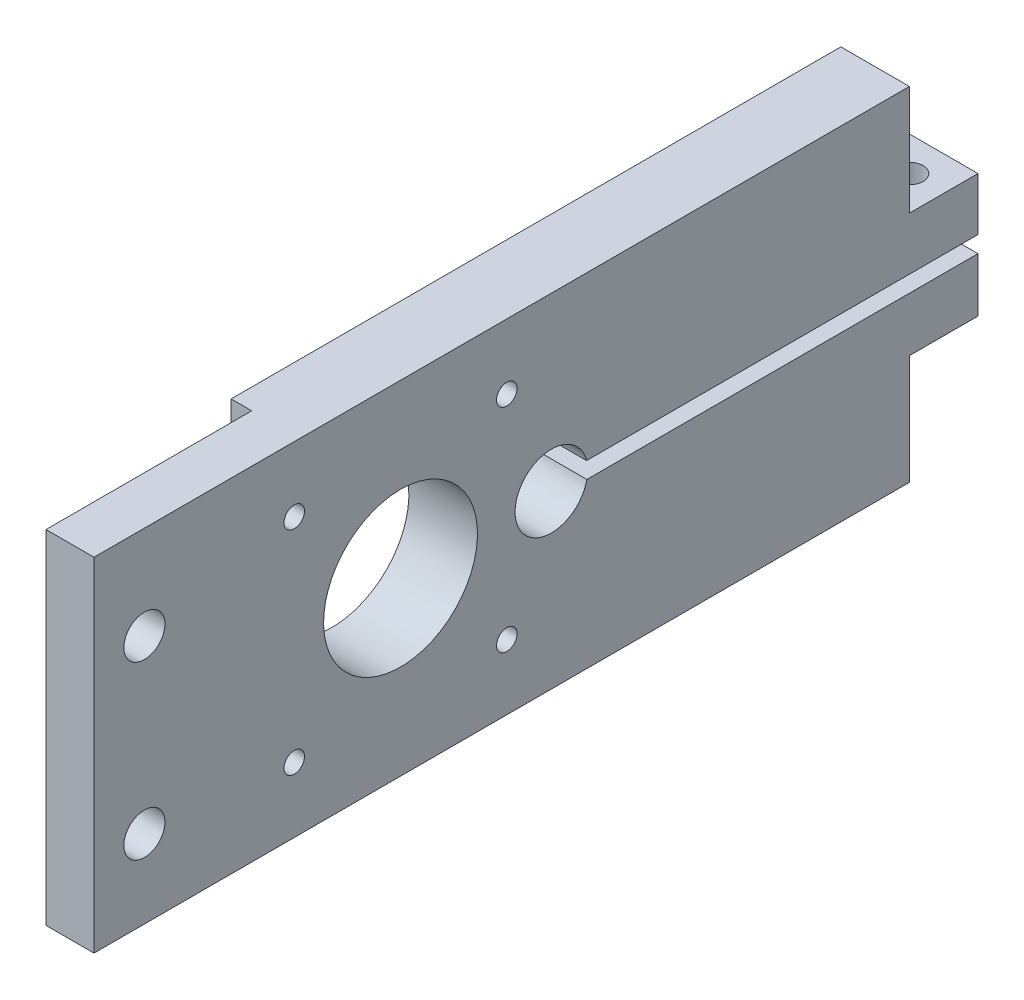
from build123d import *

# Parameters (mm, degrees)
SKETCH_1_R          = 1.5
SKETCH_1_R_2        = 5.295460532
SKETCH_1_R_3        = 3
SKETCH_1_R_4        = 11.223257521
EXTRUDE_1_DEPTH     = 10
SKETCH_3_W          = 3
SKETCH_3_H          = 30
CUT_EXTRUDE_2_DEPTH = 50
CUT_EXTRUDE_3_DEPTH = 10
SKETCH_5_W          = 10
SKETCH_5_H          = 23.885605854
SKETCH_5_H_2        = 23.710254383
EXTRUDE_2_DEPTH     = 3
SKETCH_6_R          = 3.5
CUT_EXTRUDE_4_DEPTH = 5
SKETCH_7_R          = 2
CUT_EXTRUDE_5_DEPTH = 45
SKETCH_8_W          = 10
SKETCH_8_H          = 16
CUT_EXTRUDE_6_DEPTH = 10


with BuildPart() as part:
    # 草图1 → 凸台-拉伸1 (new body)
    with BuildSketch(Plane(origin=(66, 0, 0), x_dir=(0, 0, -1), z_dir=(1, 0, 0))):
        Polygon((48, 250), (-3, 250), (-17.702150009, 250), (-17.702150009, 300), (-3, 300), (48, 300), (108.216548797, 300), (108.216548797, 250), align=None)
        with Locations(Location((42.5, 259.5, 0), (0, 0, 90))):
            Circle(SKETCH_1_R, mode=Mode.SUBTRACT)
        with Locations(Location((42.5, 290.5, 0), (0, 0, 90))):
            Circle(SKETCH_1_R, mode=Mode.SUBTRACT)
        with Locations(Location((11.5, 259.5, 0), (0, 0, 90))):
            Circle(SKETCH_1_R, mode=Mode.SUBTRACT)
        with Locations(Location((11.5, 290.5, 0), (0, 0, 90))):
            Circle(SKETCH_1_R, mode=Mode.SUBTRACT)
        with Locations(Location((49, 275, 0), (0, 0, 90))):
            Circle(SKETCH_1_R_2, mode=Mode.SUBTRACT)
        with Locations(Location((-10.351075004, 286.4017148, 0), (0, 0, 90))):
            Circle(SKETCH_1_R_3, mode=Mode.SUBTRACT)
        with Locations(Location((-10.351075004, 261.4017148, 0), (0, 0, 90))):
            Circle(SKETCH_1_R_3, mode=Mode.SUBTRACT)
        with Locations(Location((27, 275, 0), (0, 0, 90))):
            Circle(SKETCH_1_R_4, mode=Mode.SUBTRACT)
    extrude(amount=EXTRUDE_1_DEPTH)

    # 草图3 → 切除-拉伸2 (cut)
    with BuildSketch(Plane.XZ.offset(-250)):
        with Locations((67.5, 2.702150009)):
            Rectangle(SKETCH_3_W, SKETCH_3_H)
    extrude(amount=-CUT_EXTRUDE_2_DEPTH, mode=Mode.SUBTRACT)

    # 草图4 → 切除-拉伸3 (cut)
    with BuildSketch(Plane(origin=(76, 0, 0), x_dir=(0, 0, -1), z_dir=(1, 0, 0))):
        Polygon((108.216548797, 276.289745617), (49.527425716, 276.289745617), (49.527425716, 273.885605854), (109.527425716, 273.885605854), (109.527425716, 276.289745617), align=None)
    extrude(amount=-CUT_EXTRUDE_3_DEPTH, mode=Mode.SUBTRACT)

    # 草图5 → 凸台-拉伸2 (add)
    with BuildSketch(Plane(origin=(0, 0, -108.216548797), x_dir=(-1, 0, 0), z_dir=(0, 0, -1))):
        with Locations((-71, 261.942802927)):
            Rectangle(SKETCH_5_W, SKETCH_5_H)
        with Locations((-71, 288.144872808)):
            Rectangle(SKETCH_5_W, SKETCH_5_H_2)
    extrude(amount=EXTRUDE_2_DEPTH)

    # 草图6 → 切除-拉伸4 (cut)
    with BuildSketch(Plane(origin=(0, 300, 0), x_dir=(1, 0, 0), z_dir=(0, 1, 0))):
        with Locations(Location((71, 106.216548797, 0), (0, 0, 180))):
            Circle(SKETCH_6_R)
    extrude(amount=-CUT_EXTRUDE_4_DEPTH, mode=Mode.SUBTRACT)

    # 草图7 → 切除-拉伸5 (cut)
    with BuildSketch(Plane(origin=(0, 295, 0), x_dir=(1, 0, 0), z_dir=(0, 1, 0))):
        with Locations(Location((71, 106.216548797, 0), (0, 0, 180))):
            Circle(SKETCH_7_R)
    extrude(amount=-CUT_EXTRUDE_5_DEPTH, mode=Mode.SUBTRACT)

    # 草图8 → 切除-拉伸6 (cut)
    with BuildSketch(Plane.ZY.offset(-66)):
        with Locations((-106.216548797, 292)):
            Rectangle(SKETCH_8_W, SKETCH_8_H)
        with Locations((-106.216548797, 258)):
            Rectangle(SKETCH_8_W, SKETCH_8_H)
    extrude(amount=-CUT_EXTRUDE_6_DEPTH, mode=Mode.SUBTRACT)


solid = part.part
